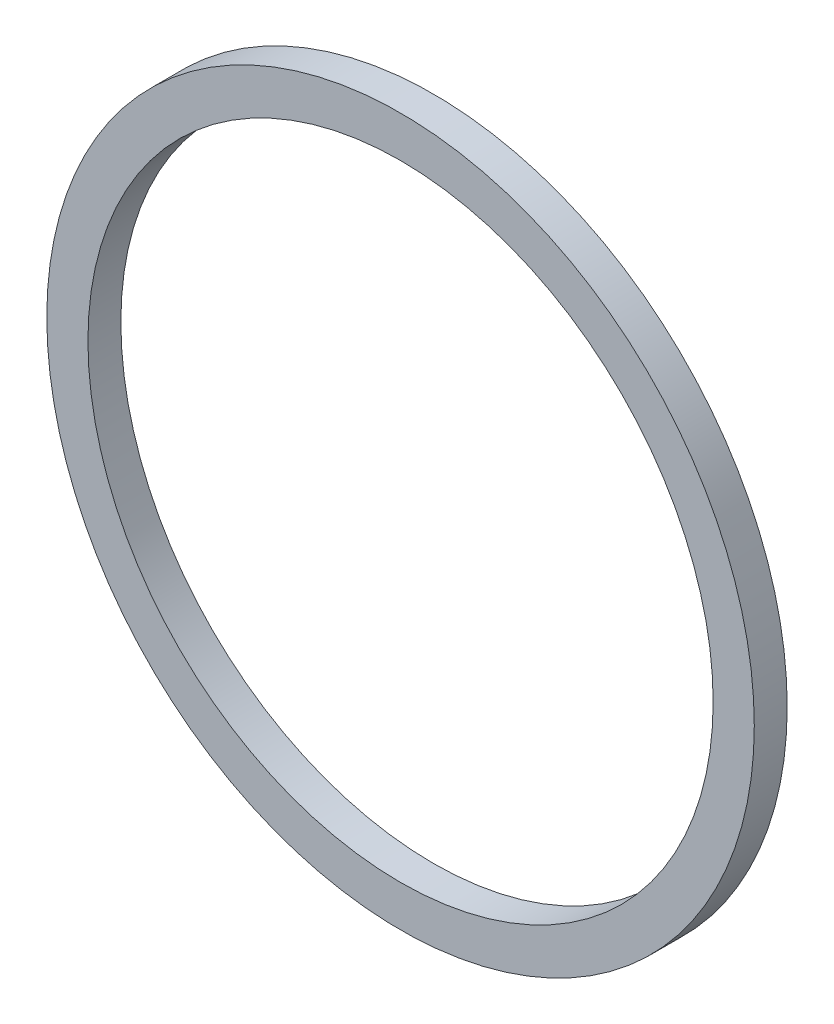
from build123d import *

# Parameters (mm, degrees)
SKETCH_1_R      = 43
SKETCH_1_R_2    = 38
EXTRUDE_1_DEPTH = 4


with BuildPart() as part:
    # 草图1 → 凸台-拉伸1 (new body)
    with BuildSketch(Plane.XY):
        Circle(SKETCH_1_R)
        Circle(SKETCH_1_R_2, mode=Mode.SUBTRACT)
    extrude(amount=EXTRUDE_1_DEPTH)


solid = part.part
